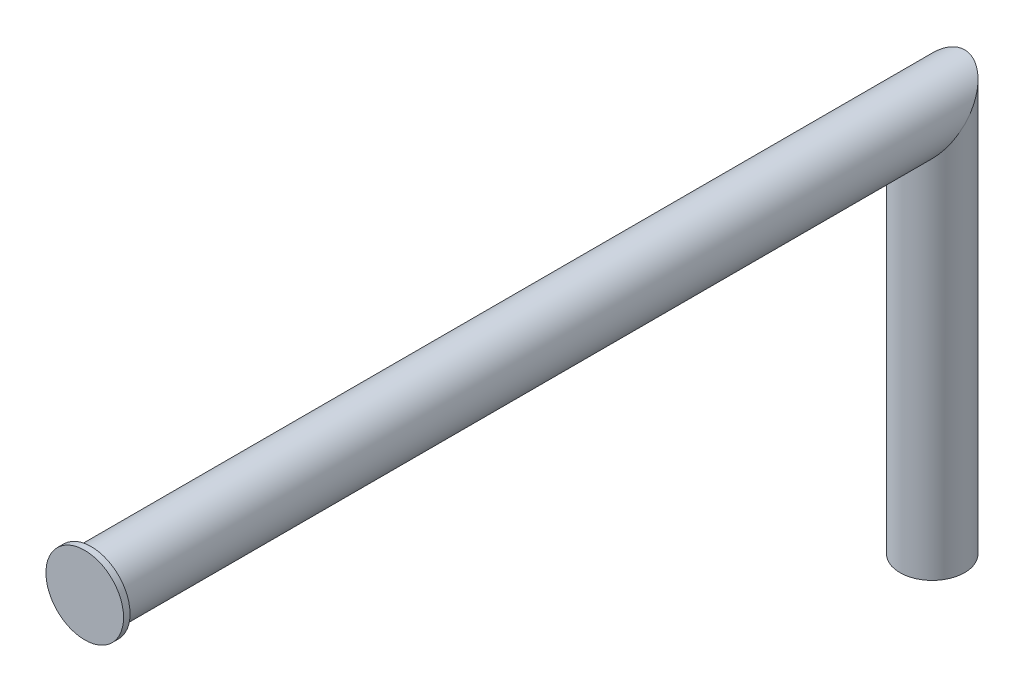
from build123d import *

# Parameters (mm, degrees)
SKETCH2_R           = 12.7
SKETCH3_R           = 15.24
BOSS_EXTRUDE1_DEPTH = 2.54


with BuildPart() as part:
    # Sweep1: sweep along a path in Sketch1
    with BuildLine(Plane(origin=(0, 0, 0), x_dir=(0, 0, -1), z_dir=(1, 0, 0))) as sweep1_path:
        Line((0, 0), (330.2, 0))
        Line((330.2, 0), (330.2, -152.4))
    # Sketch2 → Sweep1 (sweep)
    with BuildSketch(Plane.XY):
        Circle(SKETCH2_R)
    sweep(path=sweep1_path.line, transition=Transition.RIGHT)

    # Sketch3 → Boss-Extrude1 (add)
    with BuildSketch(Plane.XY):
        Circle(SKETCH3_R)
    extrude(amount=BOSS_EXTRUDE1_DEPTH)


solid = part.part
